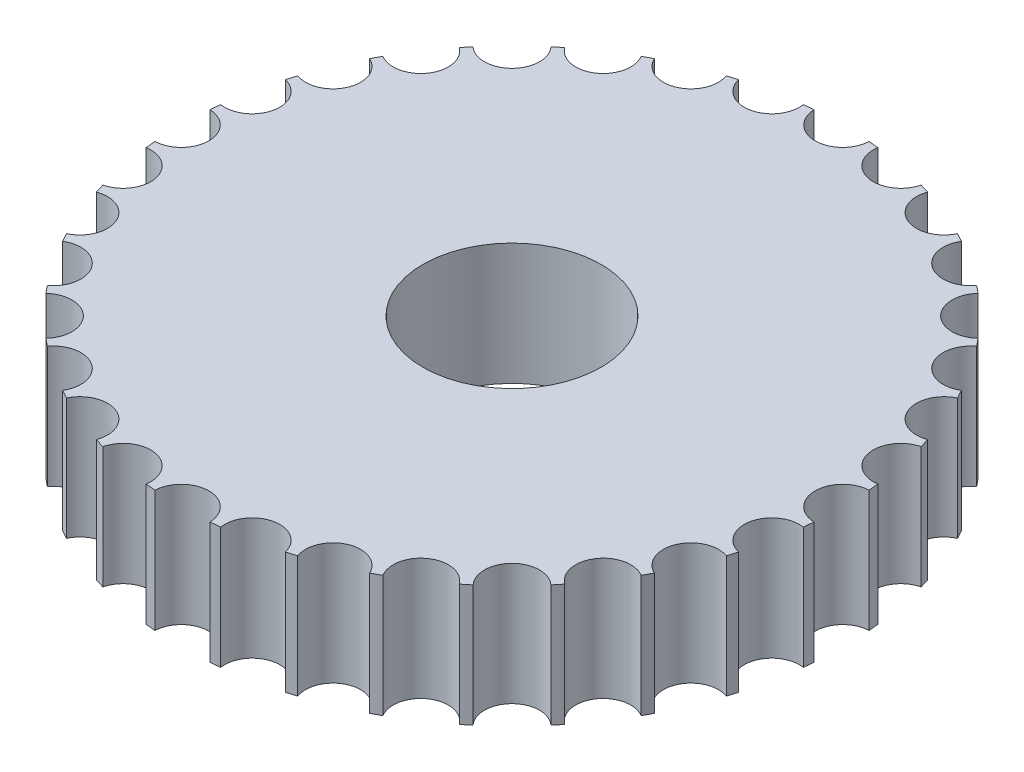
from build123d import *

# Parameters (mm, degrees)
SKETCH1_R           = 11
BOSS_EXTRUDE1_DEPTH = 15


with BuildPart() as part:
    # Sketch1 → Boss-Extrude1 (new body)
    with BuildSketch(Plane(origin=(0, 0, 0), x_dir=(1, 0, 0), z_dir=(0, 1, 0))):
        with BuildLine():
            ThreePointArc((40.667554182, -3.397048659), (37.40918895, 0), (40.667554182, 3.397048659))
            ThreePointArc((40.667554182, 3.397048659), (40.61268155, 4), (40.548869848, 4.602070919))
            ThreePointArc((40.548869848, 4.602070919), (36.690381874, 7.298170719), (39.223407215, 11.265621563))
            ThreePointArc((39.223407215, 11.265621563), (39.051958974, 11.846282243), (38.871915187, 12.424335493))
            ThreePointArc((38.871915187, 12.424335493), (34.561583998, 14.315876829), (36.271926705, 18.701262947))
            ThreePointArc((36.271926705, 18.701262947), (35.990491515, 19.237318503), (35.701134624, 19.769139821))
            ThreePointArc((35.701134624, 19.769139821), (31.104603832, 20.783431822), (31.926536394, 25.418225285))
            ThreePointArc((31.926536394, 25.418225285), (31.545929651, 25.889075402), (31.158379479, 26.354227193))
            ThreePointArc((31.158379479, 26.354227193), (26.452291185, 26.452291185), (26.354227193, 31.158379479))
            ThreePointArc((26.354227193, 31.158379479), (25.889075402, 31.545929651), (25.418225285, 31.926536394))
            ThreePointArc((25.418225285, 31.926536394), (20.783431822, 31.104603832), (19.769139821, 35.701134624))
            ThreePointArc((19.769139821, 35.701134624), (19.237318503, 35.990491515), (18.701262947, 36.271926705))
            ThreePointArc((18.701262947, 36.271926705), (14.315876829, 34.561583998), (12.424335493, 38.871915187))
            ThreePointArc((12.424335493, 38.871915187), (11.846282243, 39.051958974), (11.265621563, 39.223407215))
            ThreePointArc((11.265621563, 39.223407215), (7.298170719, 36.690381874), (4.602070919, 40.548869848))
            ThreePointArc((4.602070919, 40.548869848), (4, 40.61268155), (3.397048659, 40.667554182))
            ThreePointArc((3.397048659, 40.667554182), (0, 37.40918895), (-3.397048659, 40.667554182))
            ThreePointArc((-3.397048659, 40.667554182), (-4, 40.61268155), (-4.602070919, 40.548869848))
            ThreePointArc((-4.602070919, 40.548869848), (-7.298170719, 36.690381874), (-11.265621563, 39.223407215))
            ThreePointArc((-11.265621563, 39.223407215), (-11.846282243, 39.051958974), (-12.424335493, 38.871915187))
            ThreePointArc((-12.424335493, 38.871915187), (-14.315876829, 34.561583998), (-18.701262947, 36.271926705))
            ThreePointArc((-18.701262947, 36.271926705), (-19.237318503, 35.990491515), (-19.769139821, 35.701134624))
            ThreePointArc((-19.769139821, 35.701134624), (-20.783431822, 31.104603832), (-25.418225285, 31.926536394))
            ThreePointArc((-25.418225285, 31.926536394), (-25.889075402, 31.545929651), (-26.354227193, 31.158379479))
            ThreePointArc((-26.354227193, 31.158379479), (-26.452291185, 26.452291185), (-31.158379479, 26.354227193))
            ThreePointArc((-31.158379479, 26.354227193), (-31.545929651, 25.889075402), (-31.926536394, 25.418225285))
            ThreePointArc((-31.926536394, 25.418225285), (-31.104603832, 20.783431822), (-35.701134624, 19.769139821))
            ThreePointArc((-35.701134624, 19.769139821), (-35.990491515, 19.237318503), (-36.271926705, 18.701262947))
            ThreePointArc((-36.271926705, 18.701262947), (-34.561583998, 14.315876829), (-38.871915187, 12.424335493))
            ThreePointArc((-38.871915187, 12.424335493), (-39.051958974, 11.846282243), (-39.223407215, 11.265621563))
            ThreePointArc((-39.223407215, 11.265621563), (-36.690381874, 7.298170719), (-40.548869848, 4.602070919))
            ThreePointArc((-40.548869848, 4.602070919), (-40.61268155, 4), (-40.667554182, 3.397048659))
            ThreePointArc((-40.667554182, 3.397048659), (-37.40918895, 0), (-40.667554182, -3.397048659))
            ThreePointArc((-40.667554182, -3.397048659), (-40.61268155, -4), (-40.548869848, -4.602070919))
            ThreePointArc((-40.548869848, -4.602070919), (-36.690381874, -7.298170719), (-39.223407215, -11.265621563))
            ThreePointArc((-39.223407215, -11.265621563), (-39.051958974, -11.846282243), (-38.871915187, -12.424335493))
            ThreePointArc((-38.871915187, -12.424335493), (-34.561583998, -14.315876829), (-36.271926705, -18.701262947))
            ThreePointArc((-36.271926705, -18.701262947), (-35.990491515, -19.237318503), (-35.701134624, -19.769139821))
            ThreePointArc((-35.701134624, -19.769139821), (-31.104603832, -20.783431822), (-31.926536394, -25.418225285))
            ThreePointArc((-31.926536394, -25.418225285), (-31.545929651, -25.889075402), (-31.158379479, -26.354227193))
            ThreePointArc((-31.158379479, -26.354227193), (-26.452291185, -26.452291185), (-26.354227193, -31.158379479))
            ThreePointArc((-26.354227193, -31.158379479), (-25.889075402, -31.545929651), (-25.418225285, -31.926536394))
            ThreePointArc((-25.418225285, -31.926536394), (-20.783431822, -31.104603832), (-19.769139821, -35.701134624))
            ThreePointArc((-19.769139821, -35.701134624), (-19.237318503, -35.990491515), (-18.701262947, -36.271926705))
            ThreePointArc((-18.701262947, -36.271926705), (-14.315876829, -34.561583998), (-12.424335493, -38.871915187))
            ThreePointArc((-12.424335493, -38.871915187), (-11.846282243, -39.051958974), (-11.265621563, -39.223407215))
            ThreePointArc((-11.265621563, -39.223407215), (-7.298170719, -36.690381874), (-4.602070919, -40.548869848))
            ThreePointArc((-4.602070919, -40.548869848), (-4, -40.61268155), (-3.397048659, -40.667554182))
            ThreePointArc((-3.397048659, -40.667554182), (0, -37.40918895), (3.397048659, -40.667554182))
            ThreePointArc((3.397048659, -40.667554182), (4, -40.61268155), (4.602070919, -40.548869848))
            ThreePointArc((4.602070919, -40.548869848), (7.298170719, -36.690381874), (11.265621563, -39.223407215))
            ThreePointArc((11.265621563, -39.223407215), (11.846282243, -39.051958974), (12.424335493, -38.871915187))
            ThreePointArc((12.424335493, -38.871915187), (14.315876829, -34.561583998), (18.701262947, -36.271926705))
            ThreePointArc((18.701262947, -36.271926705), (19.237318503, -35.990491515), (19.769139821, -35.701134624))
            ThreePointArc((19.769139821, -35.701134624), (20.783431822, -31.104603832), (25.418225285, -31.926536394))
            ThreePointArc((25.418225285, -31.926536394), (25.889075402, -31.545929651), (26.354227193, -31.158379479))
            ThreePointArc((26.354227193, -31.158379479), (26.452291185, -26.452291185), (31.158379479, -26.354227193))
            ThreePointArc((31.158379479, -26.354227193), (31.545929651, -25.889075402), (31.926536394, -25.418225285))
            ThreePointArc((31.926536394, -25.418225285), (31.104603832, -20.783431822), (35.701134624, -19.769139821))
            ThreePointArc((35.701134624, -19.769139821), (35.990491515, -19.237318503), (36.271926705, -18.701262947))
            ThreePointArc((36.271926705, -18.701262947), (34.561583998, -14.315876829), (38.871915187, -12.424335493))
            ThreePointArc((38.871915187, -12.424335493), (39.051958974, -11.846282243), (39.223407215, -11.265621563))
            ThreePointArc((39.223407215, -11.265621563), (36.690381874, -7.298170719), (40.548869848, -4.602070919))
            ThreePointArc((40.548869848, -4.602070919), (40.61268155, -4), (40.667554182, -3.397048659))
        make_face()
        with Locations(Location((0, 0, 0), (0, 0, 270))):
            Circle(SKETCH1_R, mode=Mode.SUBTRACT)
    extrude(amount=BOSS_EXTRUDE1_DEPTH)


solid = part.part
